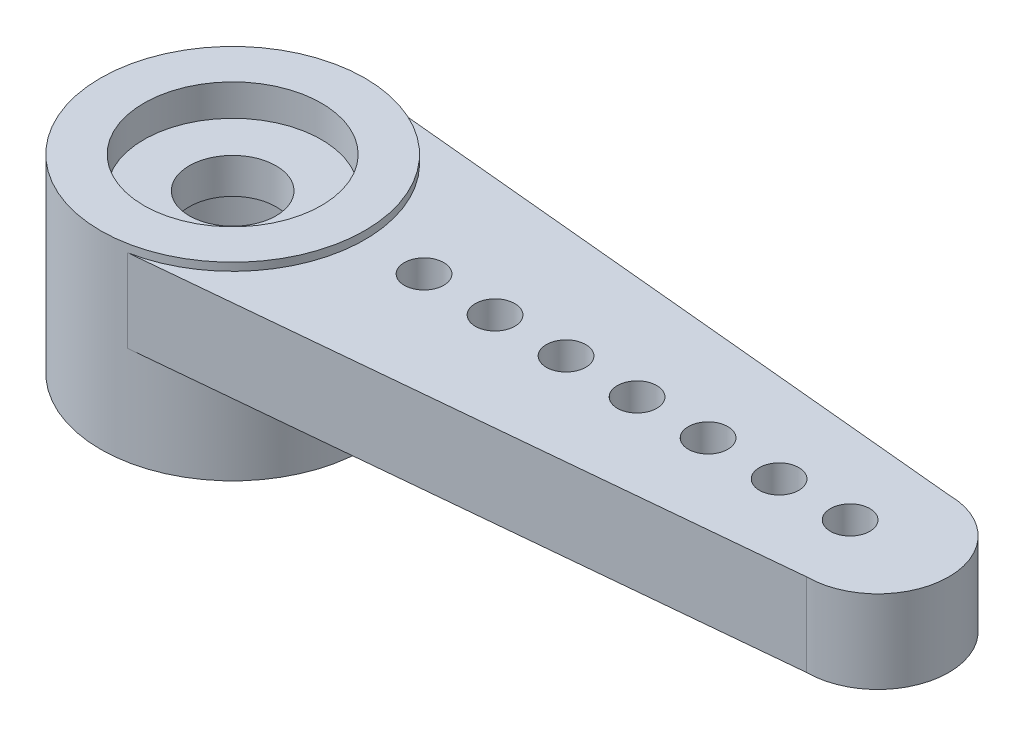
from build123d import *

# Parameters (mm, degrees)
BOSS_EXTRU_1_DEPTH      = 2.1
ESQUISSE2_R             = 2.2499999999999973
BOSS_EXTRU_2_DEPTH      = 0.2
ENL_V_START             = -0.8
ESQUISSE4_R             = 2.2499999999999973
ENL_V_MAT_EXTRU_1_DEPTH = 0.8
BOSS_EXTRU_3_START      = 2.5
ESQUISSE5_R             = 3.349999999999999
ESQUISSE5_R_2           = 2.2499999999999973
BOSS_EXTRU_3_DEPTH      = 4.8
ESQUISSE6_R             = 2.2499999999999973
ESQUISSE6_R_2           = 1.1
ENL_V_MAT_EXTRU_2_DEPTH = 3.1
ENL_V_MAT_EXTRU_3_REACH = 14.163
ESQUISSE7_R             = 0.4999999999999999
ESQUISSE7_R_2           = 0.5000000000000001
ESQUISSE7_R_3           = 0.5000000000000003
ESQUISSE7_R_4           = 0.49999999999999895


with BuildPart() as part:
    # Esquisse1 → Boss.-Extru.1 (new body)
    with BuildSketch(Plane(origin=(0, 0, 0), x_dir=(1, 0, 0), z_dir=(0, 1, 0))):
        with BuildLine():
            Line((-6.770489387338948, 3.2903216238761672), (-7.3999999999999995, 3.349999999999998))
            ThreePointArc((-7.3999999999999995, 3.349999999999998), (-9.76880771697493, 2.368807716974932), (-10.749999999999995, 1.67e-15))
            Line((-10.75, 1.97e-15), (-8.499999999999998, 1.97e-15))
            ThreePointArc((-8.499999999999998, 2.11e-15), (-7.399999999999999, 1.100000000000002), (-6.299999999999999, 1.97e-15))
            Line((-6.299999999999999, 1.97e-15), (10.75, 1.97e-15))
            ThreePointArc((10.75, 2.03e-15), (10.222792206135784, 1.2727922061357861), (8.95, 1.8000000000000005))
            Line((8.95, 1.8000000000000007), (-6.770489387338948, 3.2903216238761672))
        make_face()
        with BuildLine():
            Line((-8.499999999999998, 1.97e-15), (-10.75, 1.97e-15))
            ThreePointArc((-10.749999999999995, 1.67e-15), (-9.76880771697493, -2.3688077169749304), (-7.3999999999999995, -3.349999999999998))
            Line((-7.3999999999999995, -3.349999999999998), (-6.770489387338948, -3.2903216238761672))
            Line((-6.770489387338948, -3.2903216238761672), (8.95, -1.799999999999998))
            ThreePointArc((8.949999999999998, -1.7999999999999992), (10.222792206135784, -1.272792206135785), (10.75, 2.03e-15))
            Line((10.75, 1.97e-15), (-6.299999999999999, 1.97e-15))
            ThreePointArc((-6.299999999999999, 1.71e-15), (-7.399999999999999, -1.099999999999998), (-8.499999999999998, 2.11e-15))
        make_face()
    extrude(amount=BOSS_EXTRU_1_DEPTH)

    # Esquisse2 → Boss.-Extru.2 (add)
    # profile 1 of 3: a face of its own
    with BuildSketch(Plane(origin=(0, 2.1, 0), x_dir=(1, 0, 0), z_dir=(0, 1, 0))):
        with BuildLine():
            Line((-6.770489387338715, 3.290321623876145), (-7.399999999999999, 3.3499999999999974))
            ThreePointArc((-7.3999999999999995, 3.3499999999999974), (-10.749999999999995, 1.8e-16), (-7.4, -3.3499999999999983))
            Line((-7.3999999999999995, -3.349999999999998), (-6.770489387338895, -3.2903216238761623))
            ThreePointArc((-6.770489387338895, -3.290321623876155), (-4.8182021232855305, -2.1346708701325934), (-4.050000000000001, 1.15e-15))
            ThreePointArc((-4.050000000000001, 1.97e-15), (-4.818202123285472, 2.1346708701325254), (-6.770489387338716, 3.290321623876124))
        make_face()
        with Locations(Location((-7.399999999999999, 1.97e-15, 0), (0, 0, 270))):
            Circle(ESQUISSE2_R, mode=Mode.SUBTRACT)
    # profile 2 of 3: a face of its own
    with BuildSketch(Plane(origin=(0, 2.1, 0), x_dir=(1, 0, 0), z_dir=(0, 1, 0))):
        with BuildLine():
            ThreePointArc((-6.770489387338715, 3.290321623876124), (-7.083833461594222, 3.3350470341499694), (-7.3999999999999995, 3.3499999999999996))
            Line((-7.399999999999999, 3.3499999999999974), (-6.770489387338715, 3.290321623876145))
        make_face()
    # profile 3 of 3: a face of its own
    with BuildSketch(Plane(origin=(0, 2.1, 0), x_dir=(1, 0, 0), z_dir=(0, 1, 0))):
        with BuildLine():
            Line((-6.770489387338895, -3.2903216238761623), (-7.3999999999999995, -3.349999999999998))
            ThreePointArc((-7.3999999999999995, -3.349999999999996), (-7.0838334615943115, -3.3350470341499743), (-6.770489387338895, -3.290321623876155))
        make_face()
    extrude(amount=BOSS_EXTRU_2_DEPTH)

    # Esquisse4 → Enlèv. mat.-Extru.1 (cut)
    with BuildSketch(Plane(origin=(0, 2.3000000000000003, 0), x_dir=(1, 0, 0), z_dir=(0, 1, 0)).offset(ENL_V_START)):
        with Locations(Location((-7.399999999999999, 1.97e-15, 0), (0, 0, 270))):
            Circle(ESQUISSE4_R)
    extrude(amount=ENL_V_MAT_EXTRU_1_DEPTH, mode=Mode.SUBTRACT)

    # Esquisse5 → Boss.-Extru.3 (add)
    with BuildSketch(Plane.XZ.offset(BOSS_EXTRU_3_START)):
        with Locations(Location((-7.399999999999999, -1.97e-15, 0), (0, 0, 90))):
            Circle(ESQUISSE5_R)
        with Locations(Location((-7.399999999999999, -1.97e-15, 0), (0, 0, 90))):
            Circle(ESQUISSE5_R_2, mode=Mode.SUBTRACT)
    extrude(amount=-BOSS_EXTRU_3_DEPTH)

    # Esquisse6 → Enlèv. mat.-Extru.2 (cut)
    with BuildSketch(Plane.XZ.offset(2.499999999999999)):
        with Locations(Location((-7.399999999999999, -1.97e-15, 0), (0, 0, 90))):
            Circle(ESQUISSE6_R)
        with Locations(Location((-7.399999999999999, -1.97e-15, 0), (0, 0, 270))):
            Circle(ESQUISSE6_R_2, mode=Mode.SUBTRACT)
    extrude(amount=-ENL_V_MAT_EXTRU_2_DEPTH, mode=Mode.SUBTRACT)

    # Esquisse7 → Enlèv. mat.-Extru.3 (cut, up to next)
    with BuildSketch(Plane(origin=(0, 2.1, 0), x_dir=(1, 0, 0), z_dir=(0, 1, 0)), mode=Mode.PRIVATE) as enl_v_mat_extru_3_sk1:
        with Locations(Location((-2.55, -3e-17, 0), (0, 0, 270))):
            Circle(ESQUISSE7_R)
    enl_v_mat_extru_3_tool1 = extrude(enl_v_mat_extru_3_sk1.sketch, amount=-ENL_V_MAT_EXTRU_3_REACH, mode=Mode.PRIVATE) & part.part
    # Esquisse7 → Enlèv. mat.-Extru.3 (cut, up to next)
    with BuildSketch(Plane(origin=(0, 2.1, 0), x_dir=(1, 0, 0), z_dir=(0, 1, 0)), mode=Mode.PRIVATE) as enl_v_mat_extru_3_sk2:
        with Locations(Location((-0.7500000000000002, -1e-17, 0), (0, 0, 270))):
            Circle(ESQUISSE7_R_2)
    enl_v_mat_extru_3_tool2 = extrude(enl_v_mat_extru_3_sk2.sketch, amount=-ENL_V_MAT_EXTRU_3_REACH, mode=Mode.PRIVATE) & part.part
    # Esquisse7 → Enlèv. mat.-Extru.3 (cut, up to next)
    with BuildSketch(Plane(origin=(0, 2.1, 0), x_dir=(1, 0, 0), z_dir=(0, 1, 0)), mode=Mode.PRIVATE) as enl_v_mat_extru_3_sk3:
        with Locations(Location((1.0499999999999994, 1e-17, 0), (0, 0, 270))):
            Circle(ESQUISSE7_R_3)
    enl_v_mat_extru_3_tool3 = extrude(enl_v_mat_extru_3_sk3.sketch, amount=-ENL_V_MAT_EXTRU_3_REACH, mode=Mode.PRIVATE) & part.part
    # Esquisse7 → Enlèv. mat.-Extru.3 (cut, up to next)
    with BuildSketch(Plane(origin=(0, 2.1, 0), x_dir=(1, 0, 0), z_dir=(0, 1, 0)), mode=Mode.PRIVATE) as enl_v_mat_extru_3_sk4:
        with Locations(Location((2.8499999999999988, 2e-17, 0), (0, 0, 270))):
            Circle(ESQUISSE7_R_3)
    enl_v_mat_extru_3_tool4 = extrude(enl_v_mat_extru_3_sk4.sketch, amount=-ENL_V_MAT_EXTRU_3_REACH, mode=Mode.PRIVATE) & part.part
    # Esquisse7 → Enlèv. mat.-Extru.3 (cut, up to next)
    with BuildSketch(Plane(origin=(0, 2.1, 0), x_dir=(1, 0, 0), z_dir=(0, 1, 0)), mode=Mode.PRIVATE) as enl_v_mat_extru_3_sk5:
        with Locations(Location((4.649999999999998, 4e-17, 0), (0, 0, 270))):
            Circle(ESQUISSE7_R)
    enl_v_mat_extru_3_tool5 = extrude(enl_v_mat_extru_3_sk5.sketch, amount=-ENL_V_MAT_EXTRU_3_REACH, mode=Mode.PRIVATE) & part.part
    # Esquisse7 → Enlèv. mat.-Extru.3 (cut, up to next)
    with BuildSketch(Plane(origin=(0, 2.1, 0), x_dir=(1, 0, 0), z_dir=(0, 1, 0)), mode=Mode.PRIVATE) as enl_v_mat_extru_3_sk6:
        with Locations(Location((6.4499999999999975, 6e-17, 0), (0, 0, 270))):
            Circle(ESQUISSE7_R_4)
    enl_v_mat_extru_3_tool6 = extrude(enl_v_mat_extru_3_sk6.sketch, amount=-ENL_V_MAT_EXTRU_3_REACH, mode=Mode.PRIVATE) & part.part
    # Esquisse7 → Enlèv. mat.-Extru.3 (cut, up to next)
    with BuildSketch(Plane(origin=(0, 2.1, 0), x_dir=(1, 0, 0), z_dir=(0, 1, 0)), mode=Mode.PRIVATE) as enl_v_mat_extru_3_sk7:
        with Locations(Location((8.249999999999996, 8e-17, 0), (0, 0, 270))):
            Circle(ESQUISSE7_R_4)
    enl_v_mat_extru_3_tool7 = extrude(enl_v_mat_extru_3_sk7.sketch, amount=-ENL_V_MAT_EXTRU_3_REACH, mode=Mode.PRIVATE) & part.part
    add(enl_v_mat_extru_3_tool1.solids().sort_by_distance((-2.55, 2.1, 0))[0], mode=Mode.SUBTRACT)
    add(enl_v_mat_extru_3_tool2.solids().sort_by_distance((-0.75, 2.1, 0))[0], mode=Mode.SUBTRACT)
    add(enl_v_mat_extru_3_tool3.solids().sort_by_distance((1.05, 2.1, 0))[0], mode=Mode.SUBTRACT)
    add(enl_v_mat_extru_3_tool4.solids().sort_by_distance((2.85, 2.1, 0))[0], mode=Mode.SUBTRACT)
    add(enl_v_mat_extru_3_tool5.solids().sort_by_distance((4.65, 2.1, 0))[0], mode=Mode.SUBTRACT)
    add(enl_v_mat_extru_3_tool6.solids().sort_by_distance((6.45, 2.1, 0))[0], mode=Mode.SUBTRACT)
    add(enl_v_mat_extru_3_tool7.solids().sort_by_distance((8.25, 2.1, 0))[0], mode=Mode.SUBTRACT)


solid = part.part
